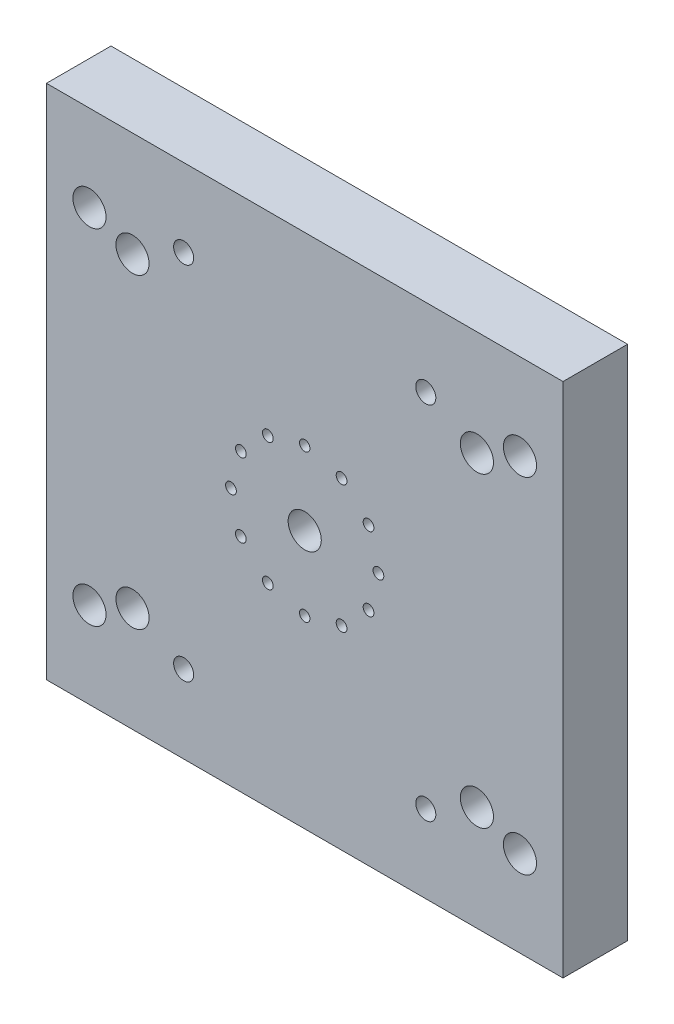
from build123d import *

# Parameters (mm, degrees)
SKETCH1_W                               = 304.8
SKETCH1_H                               = 304.8
BOSS_EXTRUDE1_DEPTH                     = 38.1
SKETCH2_R                               = 6.5151
HAAS_T_SLOT_HOLES_DEPTH                 = 219.867836833
SKETCH3_R                               = 9.779
HAAS_COUNTER_BORES_DEPTH                = 22.225
SKETCH4_R                               = 6.5151
TORMACH_T_SLOT_HOLES_DEPTH              = 219.867836833
SKETCH5_R                               = 9.779
TORMACH_COUNTER_BORES_DEPTH             = 22.225
SKETCH6_R                               = 3.0734
SPROCKET_LOCATING_HOLES_DEPTH           = 6.35
SKETCH7_R                               = 3.175
SPROCKET_MOUNTING_CLEARANCE_HOLES_DEPTH = 9.525
SKETCH8_R                               = 5.9182
F_1_2_13_TAPPED_HOLES_DEPTH             = 19.05


with BuildPart() as part:
    # Sketch1 → Boss-Extrude1 (new body)
    with BuildSketch(Plane.XY):
        Rectangle(SKETCH1_W, SKETCH1_H)
    extrude(amount=BOSS_EXTRUDE1_DEPTH)

    # Sketch2 → HAAS T-Slot Holes (cut, through all)
    with BuildSketch(Plane.XY.offset(38.1)):
        with Locations((-127, 101.6)):
            Circle(SKETCH2_R)
        with Locations((127, 101.6)):
            Circle(SKETCH2_R)
        with Locations((127, -101.6)):
            Circle(SKETCH2_R)
        with Locations((-127, -101.6)):
            Circle(SKETCH2_R)
        Circle(SKETCH2_R)
    extrude(amount=-HAAS_T_SLOT_HOLES_DEPTH, mode=Mode.SUBTRACT)

    # Sketch3 → HAAS Counter Bores (cut)
    with BuildSketch(Plane.XY.offset(38.1)):
        with Locations((-127, 101.6)):
            Circle(SKETCH3_R)
        with Locations((127, 101.6)):
            Circle(SKETCH3_R)
        Circle(SKETCH3_R)
        with Locations((127, -101.6)):
            Circle(SKETCH3_R)
        with Locations((-127, -101.6)):
            Circle(SKETCH3_R)
    extrude(amount=-HAAS_COUNTER_BORES_DEPTH, mode=Mode.SUBTRACT)

    # Sketch4 → Tormach T-Slot Holes (cut, through all)
    with BuildSketch(Plane.XY.offset(38.1)):
        with Locations((-101.6, 90.4875)):
            Circle(SKETCH4_R)
        with Locations((101.6, 90.4875)):
            Circle(SKETCH4_R)
        with Locations((-101.6, -90.4875)):
            Circle(SKETCH4_R)
        with Locations((101.6, -90.4875)):
            Circle(SKETCH4_R)
    extrude(amount=-TORMACH_T_SLOT_HOLES_DEPTH, mode=Mode.SUBTRACT)

    # Sketch5 → Tormach Counter bores (cut)
    with BuildSketch(Plane.XY.offset(38.1)):
        with Locations((-101.6, 90.4875)):
            Circle(SKETCH5_R)
        with Locations((101.6, 90.4875)):
            Circle(SKETCH5_R)
        with Locations((101.6, -90.4875)):
            Circle(SKETCH5_R)
        with Locations((-101.6, -90.4875)):
            Circle(SKETCH5_R)
    extrude(amount=-TORMACH_COUNTER_BORES_DEPTH, mode=Mode.SUBTRACT)

    # Sketch6 → Sprocket Locating Holes (cut)
    with BuildSketch(Plane.XY.offset(38.1)):
        with Locations((0, 43.50004)):
            Circle(SKETCH6_R)
        with Locations((0, -43.50004)):
            Circle(SKETCH6_R)
    extrude(amount=-SPROCKET_LOCATING_HOLES_DEPTH, mode=Mode.SUBTRACT)

    # Sketch7 → Sprocket Mounting clearance holes (cut)
    with BuildSketch(Plane.XY.offset(38.1)):
        with Locations((43.50004, 0)):
            Circle(SKETCH7_R)
        with Locations((37.672139706, -21.75002)):
            Circle(SKETCH7_R)
        with Locations((21.75002, -37.672139706)):
            Circle(SKETCH7_R)
        with Locations((-21.75002, -37.672139706)):
            Circle(SKETCH7_R)
        with Locations((-37.672139706, -21.75002)):
            Circle(SKETCH7_R)
        with Locations((-43.50004, 0)):
            Circle(SKETCH7_R)
        with Locations((-37.672139706, 21.75002)):
            Circle(SKETCH7_R)
        with Locations((-21.75002, 37.672139706)):
            Circle(SKETCH7_R)
        with Locations((21.75002, 37.672139706)):
            Circle(SKETCH7_R)
        with Locations((37.672139706, 21.75002)):
            Circle(SKETCH7_R)
    extrude(amount=-SPROCKET_MOUNTING_CLEARANCE_HOLES_DEPTH, mode=Mode.SUBTRACT)

    # Sketch8 → 1/2-13 Tapped Holes (cut)
    with BuildSketch(Plane.XY.offset(38.1)):
        with Locations((-71.4375, 106.4641)):
            Circle(SKETCH8_R)
        with Locations((71.4375, 106.4641)):
            Circle(SKETCH8_R)
        with Locations((71.4375, -106.4641)):
            Circle(SKETCH8_R)
        with Locations((-71.4375, -106.4641)):
            Circle(SKETCH8_R)
    extrude(amount=-F_1_2_13_TAPPED_HOLES_DEPTH, mode=Mode.SUBTRACT)


solid = part.part
